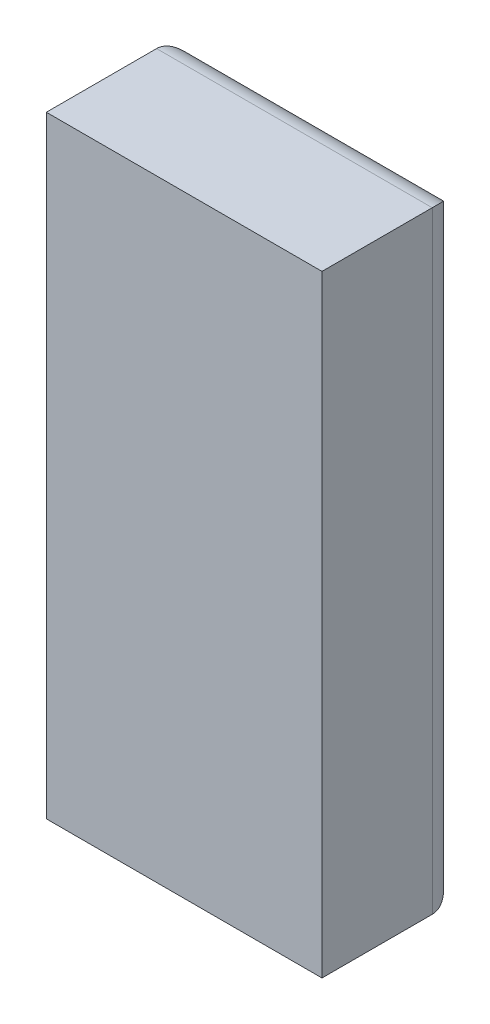
from build123d import *

# Parameters (mm, degrees)
PROFILE_SKETCH_W      = 100
PROFILE_SKETCH_H      = 222
PROFILE_EXTRUDE_DEPTH = 50
FILLET1_R             = 10


with BuildPart() as part:
    # Profile Sketch → Profile Extrude (new body)
    with BuildSketch(Plane.XY):
        Rectangle(PROFILE_SKETCH_W, PROFILE_SKETCH_H)
    extrude(amount=-PROFILE_EXTRUDE_DEPTH)

    # Fillet1
    fillet1_edges = [part.edges().sort_by_distance(p)[0] for p in [
        (-50, 0, -50),
        (0, -111, -50),
        (50, 0, -50),
        (0, 111, -50),
    ]]
    fillet(fillet1_edges, radius=FILLET1_R)


solid = part.part
